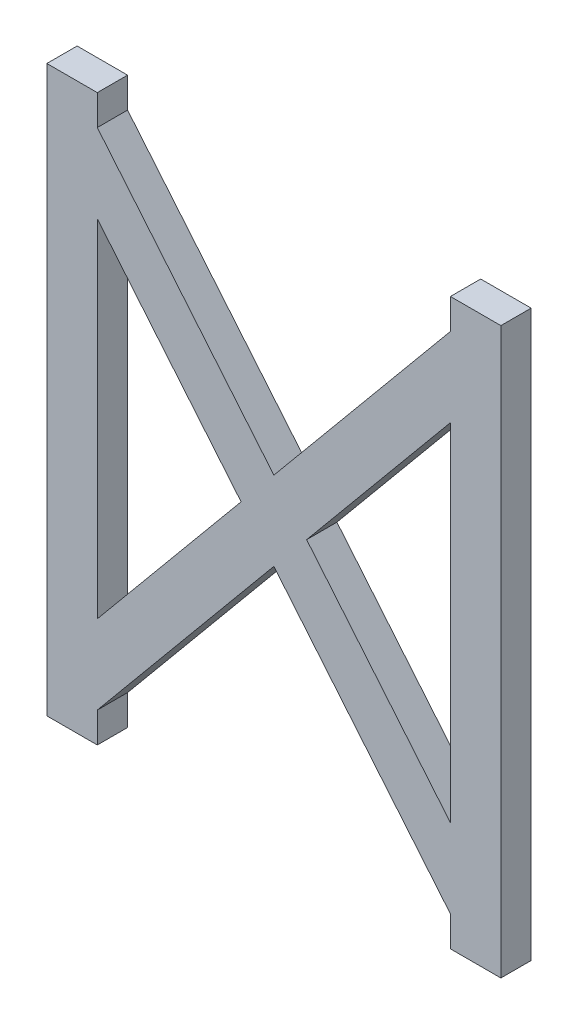
from build123d import *

# Parameters (mm, degrees)
BOSS_EXTRUDE1_DEPTH = 3


with BuildPart() as part:
    # Sketch1 → Boss-Extrude1 (new body)
    with BuildSketch(Plane.XY):
        Polygon((0, 56), (0, 28), (5, 28), (5, 45.17097131), (5, 53), (5, 56), align=None)
        Polygon((5, 53), (5, 45.17097131), (19.251130035, 28), (22.5, 31.914514345), align=None)
        Polygon((0, 28), (0, 0), (5, 0), (5, 3), (5, 10.82902869), (5, 28), align=None)
        Polygon((5, 10.82902869), (5, 3), (22.5, 24.085485655), (19.251130035, 28), align=None)
        Polygon((25.748869965, 28), (19.251130035, 28), (22.5, 24.085485655), align=None)
        Polygon((22.5, 31.914514345), (25.748869965, 28), (40, 45.17097131), (40, 53), align=None)
        Polygon((40, 45.17097131), (40, 28), (45, 28), (45, 56), (40, 56), (40, 53), align=None)
        Polygon((40, 10.82902869), (40, 3), (40, 0), (45, 0), (45, 28), (40, 28), align=None)
        Polygon((25.748869965, 28), (22.5, 24.085485655), (40, 3), (40, 10.82902869), align=None)
        Polygon((22.5, 31.914514345), (19.251130035, 28), (25.748869965, 28), align=None)
    extrude(amount=BOSS_EXTRUDE1_DEPTH)


solid = part.part
